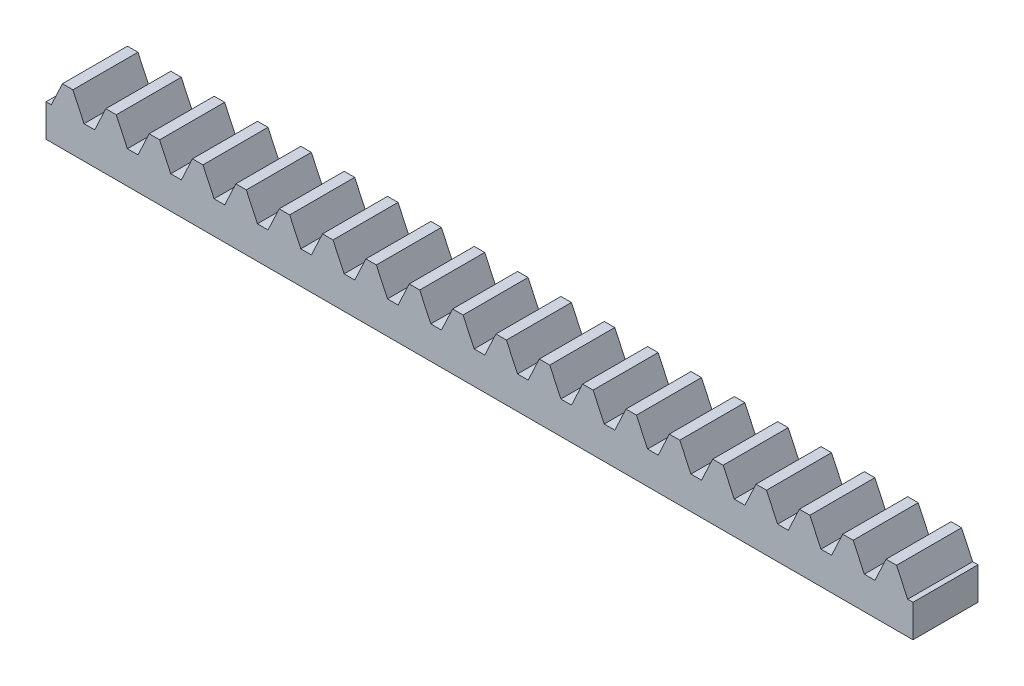
from build123d import *

# Parameters (mm, degrees)
EXTRUDE_TOOTH_DEPTH = 3
PATTERN_TEETH_COUNT = 20
PATTERN_TEETH_PITCH = 4


with BuildPart() as part:
    # Sketch1 → Extrude Tooth (new, symmetric)
    with BuildSketch(Plane.XY):
        Polygon((-0.483692342, 2.2), (0.483692342, 2.2), (1.50956919, 0), (2, 0), (2, -3), (-2, -3), (-2, 0), (-1.50956919, 0), align=None)
    extrude_tooth = extrude(amount=EXTRUDE_TOOTH_DEPTH, both=True)

    # Pattern Teeth: Extrude Tooth ×20
    with Locations(*[(i * PATTERN_TEETH_PITCH, 0, 0) for i in range(1, PATTERN_TEETH_COUNT)]):
        add(extrude_tooth)


solid = part.part
